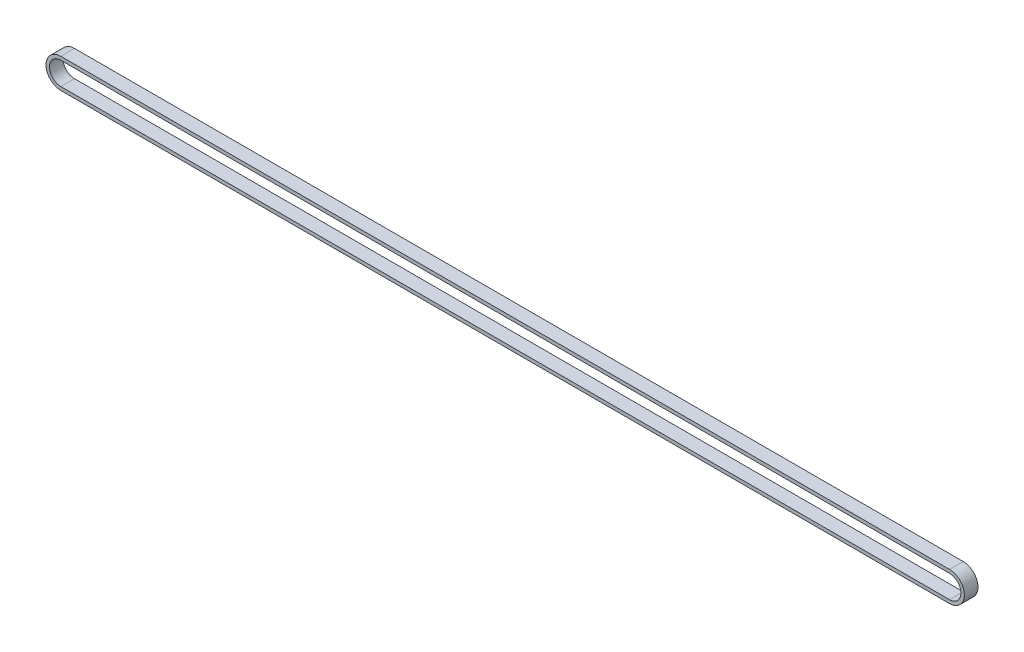
from build123d import *

# Parameters (mm, degrees)
EXTRUDE_1_DEPTH = 6


with BuildPart() as part:
    # 草图1 → 凸台-拉伸1 (new body)
    with BuildSketch(Plane.XY):
        with BuildLine():
            Line((0, 6.5), (390, 6.5))
            ThreePointArc((390, 6.5), (396.5, 0), (390, -6.5))
            Line((390, -6.5), (0, -6.5))
            ThreePointArc((0, -6.5), (-6.5, 0), (0, 6.5))
        make_face()
        with BuildLine():
            Line((0, 5), (390, 5))
            ThreePointArc((390, 5), (395, 0), (390, -5))
            Line((390, -5), (0, -5))
            ThreePointArc((0, -5), (-5, 0), (0, 5))
        make_face(mode=Mode.SUBTRACT)
    extrude(amount=EXTRUDE_1_DEPTH)


solid = part.part
